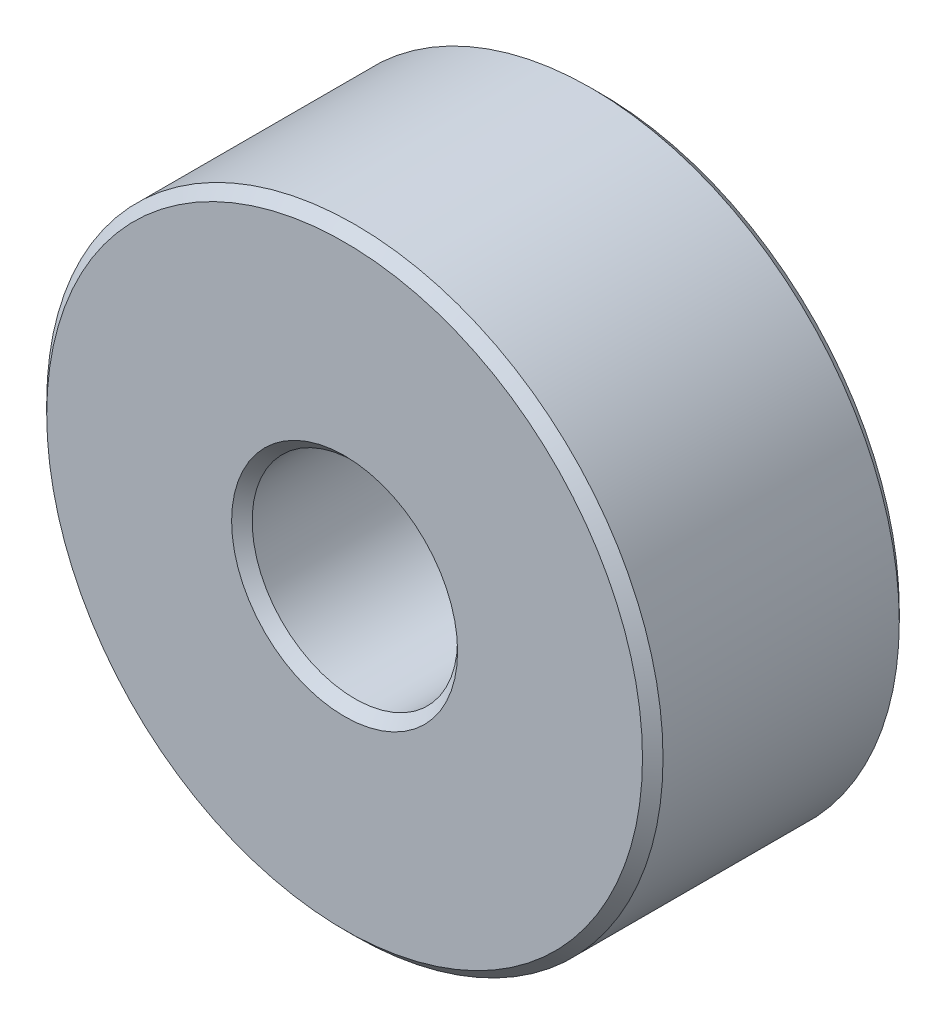
from build123d import *

# Parameters (mm, degrees)
SKETCH2_R           = 3
SKETCH2_R_2         = 1
BOSS_EXTRUDE1_DEPTH = 2.5
CHAMFER1_SIZE       = 0.1


with BuildPart() as part:
    # Sketch2 → Boss-Extrude1 (new body)
    with BuildSketch(Plane.XY):
        Circle(SKETCH2_R)
        Circle(SKETCH2_R_2, mode=Mode.SUBTRACT)
    extrude(amount=BOSS_EXTRUDE1_DEPTH)

    # Chamfer1
    chamfer1_edges = [part.edges().sort_by_distance(p)[0] for p in [
        (-3, 0, 0),
        (-3, 0, 2.5),
        (-1, 0, 0),
        (-1, 0, 2.5),
    ]]
    chamfer(chamfer1_edges, length=CHAMFER1_SIZE)


solid = part.part
